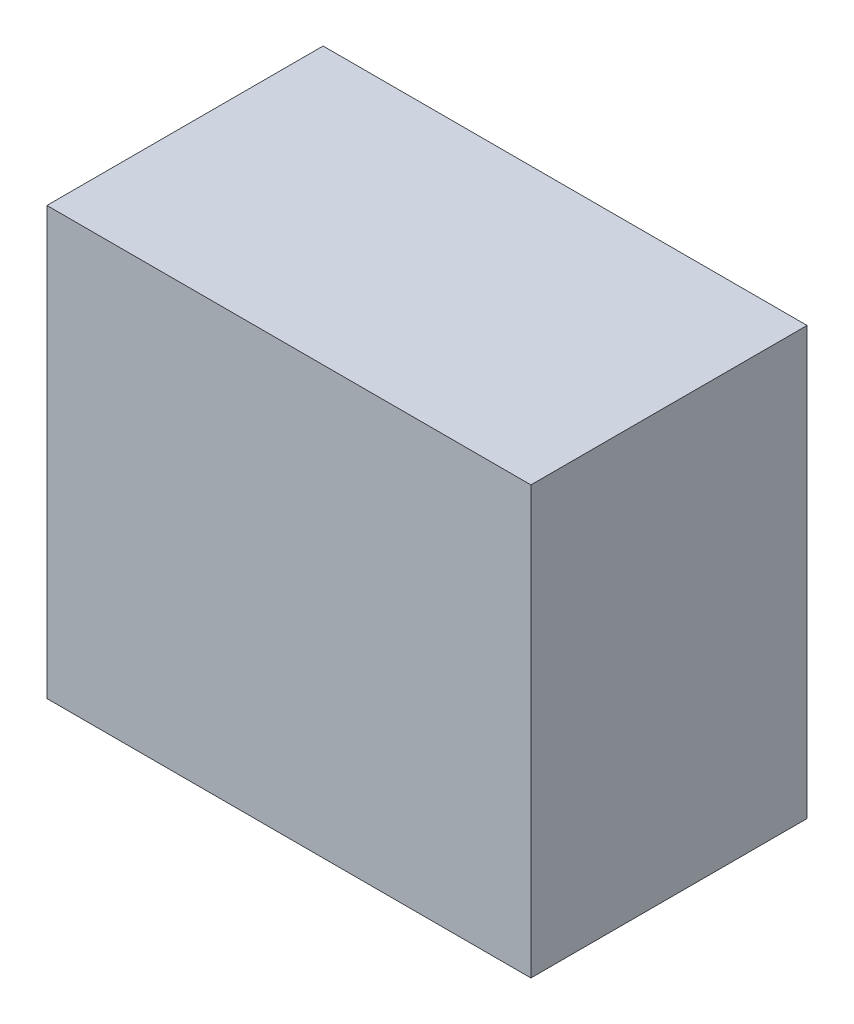
from build123d import *

# Parameters (mm, degrees)
SKETCH1_W           = 170
SKETCH1_H           = 97
BOSS_EXTRUDE1_DEPTH = 150


with BuildPart() as part:
    # Sketch1 → Boss-Extrude1 (new body)
    with BuildSketch(Plane(origin=(0, 0, 0), x_dir=(1, 0, 0), z_dir=(0, 1, 0))):
        Rectangle(SKETCH1_W, SKETCH1_H)
    extrude(amount=BOSS_EXTRUDE1_DEPTH)


solid = part.part
